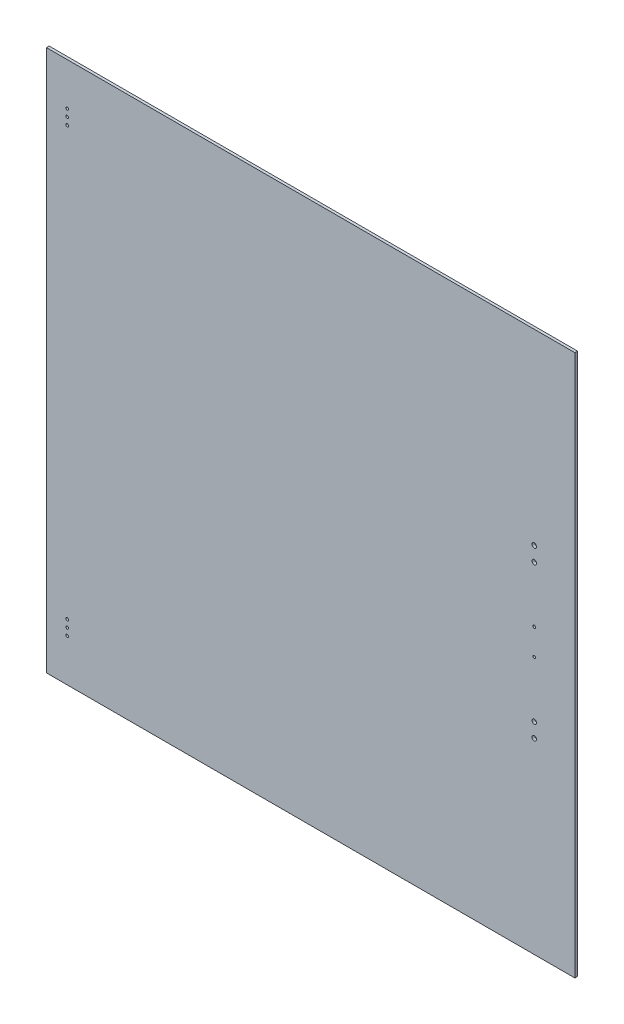
from build123d import *

# Parameters (mm, degrees)
SKETCH1_W           = 585.5
SKETCH1_H           = 600
BOSS_EXTRUDE1_DEPTH = 3
SKETCH2_R           = 1.5
CUT_EXTRUDE1_DEPTH  = 566.896627841
SKETCH3_R           = 2.5
SKETCH3_R_2         = 1.5
CUT_EXTRUDE2_DEPTH  = 566.896627841


with BuildPart() as part:
    # Sketch1 → Boss-Extrude1 (new body)
    with BuildSketch(Plane.XY):
        with Locations((-183.754854369, -5.242718447)):
            Rectangle(SKETCH1_W, SKETCH1_H)
    extrude(amount=BOSS_EXTRUDE1_DEPTH)

    # Sketch2 → Cut-Extrude1 (cut, through all)
    with BuildSketch(Plane.XY.offset(3)):
        with Locations((-453.504854369, 247.757281553)):
            Circle(SKETCH2_R)
        with Locations((-453.504854369, 239.757281553)):
            Circle(SKETCH2_R)
        with Locations((-453.504854369, 231.757281553)):
            Circle(SKETCH2_R)
        with Locations((-453.504854369, -242.242718447)):
            Circle(SKETCH2_R)
        with Locations((-453.504854369, -250.242718447)):
            Circle(SKETCH2_R)
        with Locations((-453.504854369, -258.242718447)):
            Circle(SKETCH2_R)
    extrude(amount=-CUT_EXTRUDE1_DEPTH, mode=Mode.SUBTRACT)

    # Sketch3 → Cut-Extrude2 (cut, through all)
    with BuildSketch(Plane.XY.offset(3)):
        with Locations((63.995145631, 87.257281553)):
            Circle(SKETCH3_R)
        with Locations((63.995145631, 71.257281553)):
            Circle(SKETCH3_R)
        with Locations((63.995145631, -81.742718447)):
            Circle(SKETCH3_R)
        with Locations((63.995145631, -97.742718447)):
            Circle(SKETCH3_R)
        with Locations((63.995145631, 9.257281553)):
            Circle(SKETCH3_R_2)
        with Locations((63.995145631, -19.742718447)):
            Circle(SKETCH3_R_2)
    extrude(amount=-CUT_EXTRUDE2_DEPTH, mode=Mode.SUBTRACT)


solid = part.part
